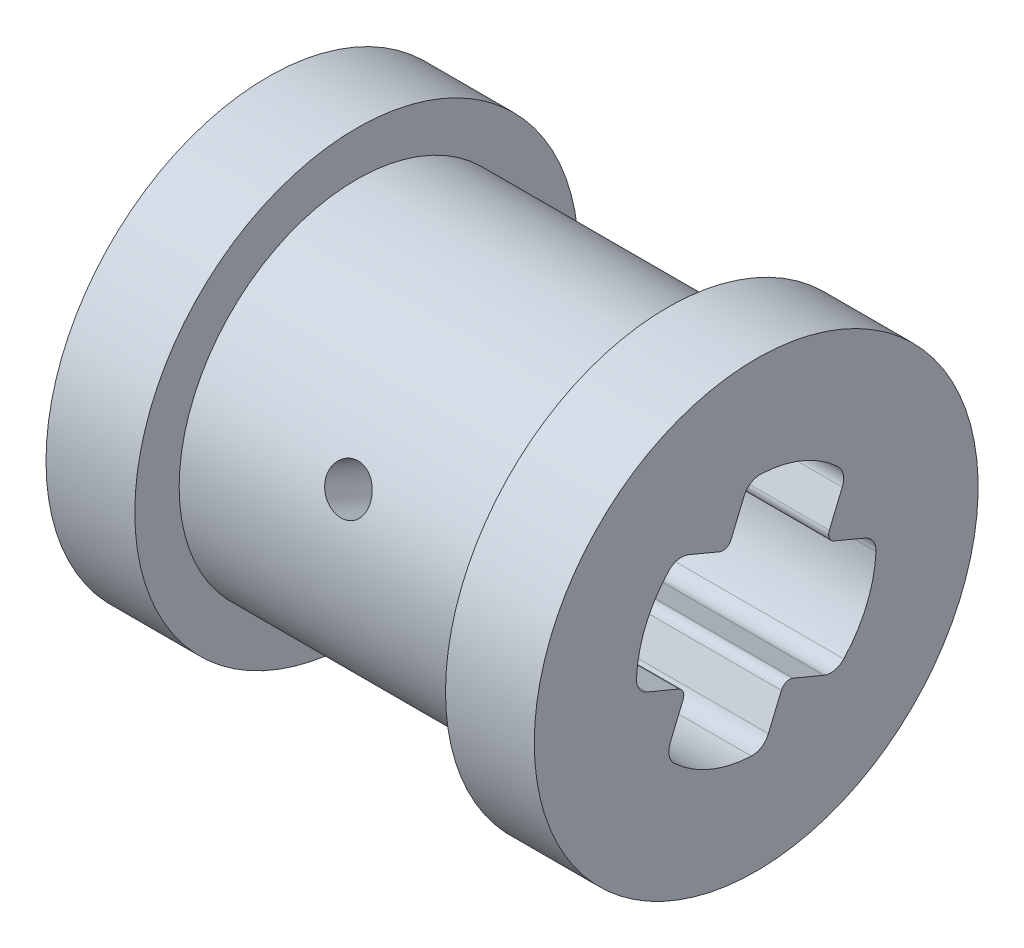
from build123d import *

# Parameters (mm, degrees)
CUT_EXTRUDE1_DEPTH      = 14.076696831
CUT_EXTRUDE2_DEPTH      = 10.105317074
CUT_EXTRUDE2_DEPTH_BACK = 10.105317074
SKETCH4_R               = 0.5


with BuildPart() as part:
    # Sketch1 → Revolve1 (revolve)
    with BuildSketch(Plane(origin=(0, 0, 0), x_dir=(1, 0, 0), z_dir=(0, 1, 0))):
        Polygon((-3.5, -5), (-3.5, -4), (3.5, -4), (3.5, -5), (5.5, -5), (5.5, 0), (-5.5, 0), (-5.5, -5), align=None)
    revolve(axis=Axis((-5.5, 0, 0), (1, 0, 0)))

    # Sketch3 → Cut-Extrude1 (cut, through all)
    with BuildSketch(Plane(origin=(5.5, 0, 0), x_dir=(0, 0, -1), z_dir=(1, 0, 0))):
        with BuildLine():
            ThreePointArc((0.110278314, 2.697746966), (-0.12087287, 2.635504953), (-0.275087283, 2.452412483))
            Line((-0.275087283, 2.452412483), (-0.566923139, 1.754593444))
            ThreePointArc((-0.566923139, 1.754593444), (-0.675530556, 1.646723678), (-0.82860304, 1.647245277))
            Line((-0.82860304, 1.647245277), (-1.526422079, 1.939081132))
            ThreePointArc((-1.526422079, 1.939081132), (-1.764789364, 1.961125979), (-1.973058824, 1.843105769))
            ThreePointArc((-1.973058824, 1.843105769), (-2.490939467, 1.041739204), (-2.697746966, 0.110278314))
            ThreePointArc((-2.697746966, 0.110278314), (-2.635504953, -0.12087287), (-2.452412483, -0.275087283))
            Line((-2.452412483, -0.275087283), (-1.754593444, -0.566923139))
            ThreePointArc((-1.754593444, -0.566923139), (-1.646723678, -0.675530556), (-1.647245277, -0.82860304))
            Line((-1.647245277, -0.82860304), (-1.939081132, -1.526422079))
            ThreePointArc((-1.939081132, -1.526422079), (-1.961125979, -1.764789364), (-1.843105769, -1.973058824))
            ThreePointArc((-1.843105769, -1.973058824), (-1.041739204, -2.490939467), (-0.110278314, -2.697746966))
            ThreePointArc((-0.110278314, -2.697746966), (0.12087287, -2.635504953), (0.275087283, -2.452412483))
            Line((0.275087283, -2.452412483), (0.566923139, -1.754593444))
            ThreePointArc((0.566923139, -1.754593444), (0.675530556, -1.646723678), (0.82860304, -1.647245277))
            Line((0.82860304, -1.647245277), (1.526422079, -1.939081132))
            ThreePointArc((1.526422079, -1.939081132), (1.764789364, -1.961125979), (1.973058824, -1.843105769))
            ThreePointArc((1.973058824, -1.843105769), (2.490939467, -1.041739204), (2.697746966, -0.110278314))
            ThreePointArc((2.697746966, -0.110278314), (2.635504953, 0.12087287), (2.452412483, 0.275087283))
            Line((2.452412483, 0.275087283), (1.754593444, 0.566923139))
            ThreePointArc((1.754593444, 0.566923139), (1.646723678, 0.675530556), (1.647245277, 0.82860304))
            Line((1.647245277, 0.82860304), (1.939081132, 1.526422079))
            ThreePointArc((1.939081132, 1.526422079), (1.961125979, 1.764789364), (1.843105769, 1.973058824))
            ThreePointArc((1.843105769, 1.973058824), (1.041739204, 2.490939467), (0.110278314, 2.697746966))
        make_face()
    extrude(amount=-CUT_EXTRUDE1_DEPTH, mode=Mode.SUBTRACT)

    # Sketch4 → Cut-Extrude2 (cut, two sides: drawn at the far end of the back side and taken through both)
    with BuildSketch(Plane(origin=(0, 0.077165867, 0.184514035), x_dir=(-1, 0, 0), z_dir=(0, -0.38582933492302907, -0.9225701731103457)).offset(-CUT_EXTRUDE2_DEPTH_BACK)):
        with Locations(Location((0, 0, 0), (0, 0, 90))):
            Circle(SKETCH4_R)
    extrude(amount=CUT_EXTRUDE2_DEPTH + CUT_EXTRUDE2_DEPTH_BACK, mode=Mode.SUBTRACT)


solid = part.part
